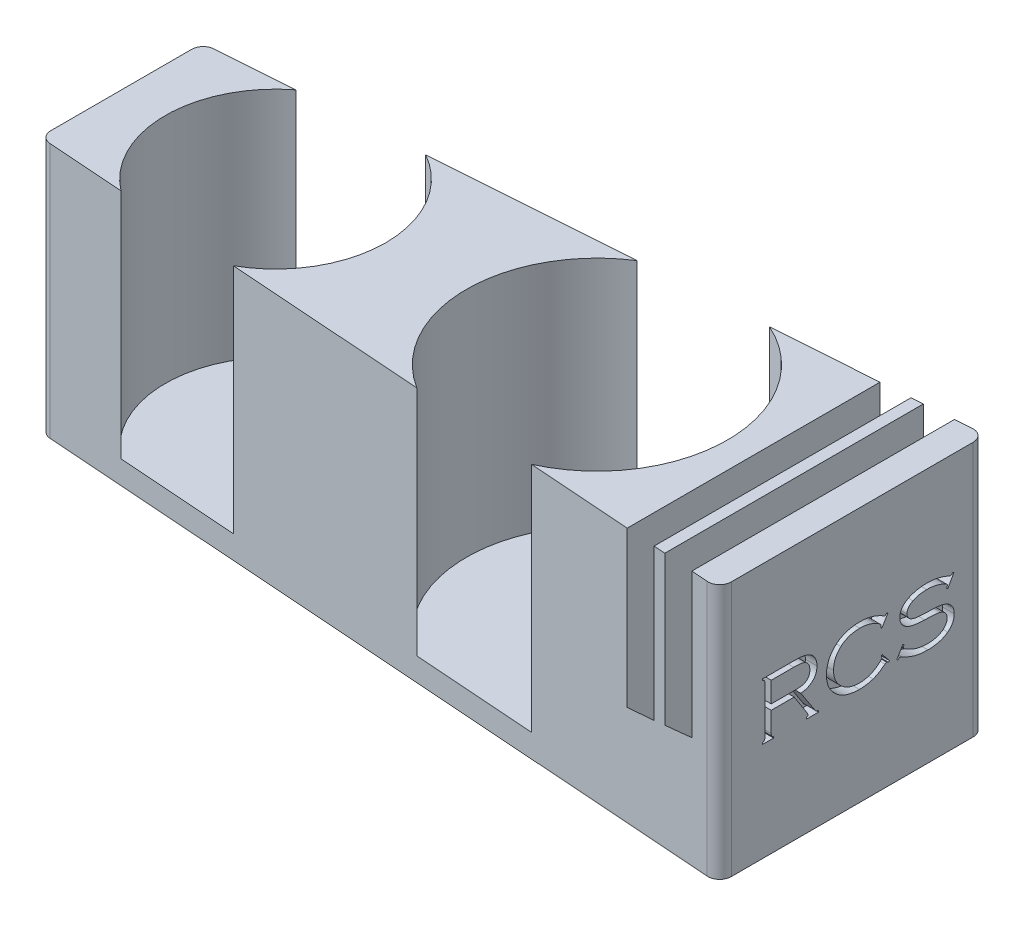
from build123d import *

# Parameters (mm, degrees)
BOSS_EXTRUDE1_DEPTH = 2
BOSS_EXTRUDE2_DEPTH = 20
BOSS_EXTRUDE3_DEPTH = 20
SKETCH5_R           = 12.25
CUT_EXTRUDE1_DEPTH  = 2.5
SKETCH6_W           = 22.642128751
SKETCH6_H           = 12.426012396
CUT_EXTRUDE3_DEPTH  = 2.5
BOSS_EXTRUDE4_DEPTH = 20
BOSS_EXTRUDE5_DEPTH = 20
SKETCH10_R          = 12.25
CUT_EXTRUDE4_DEPTH  = 2.5
CUT_EXTRUDE5_DEPTH  = 2.5
BOSS_EXTRUDE6_DEPTH = 20
SKETCH13_R          = 9.5
CUT_EXTRUDE6_DEPTH  = 20
SKETCH14_R          = 11.25
CUT_EXTRUDE7_DEPTH  = 20
CUT_EXTRUDE8_DEPTH  = 1
FILLET2_R           = 1


with BuildPart() as part:
    # Sketch1 → Boss-Extrude1 (new body)
    with BuildSketch(Plane(origin=(0, 0, 0), x_dir=(1, 0, 0), z_dir=(0, 1, 0))):
        Polygon((0, 7), (63, 11.5), (63, -11.5), (0, -7), align=None)
    extrude(amount=BOSS_EXTRUDE1_DEPTH)

    # Sketch2 → Boss-Extrude2 (add)
    with BuildSketch(Plane(origin=(0, 2, 0), x_dir=(1, 0, 0), z_dir=(0, 1, 0))):
        Polygon((60.497356291, 11.321239735), (60.497356495, -11.32123975), (63, -11.5), (63, 11.5), align=None)
    extrude(amount=BOSS_EXTRUDE2_DEPTH)

    # Sketch4 → Boss-Extrude3 (add)
    with BuildSketch(Plane(origin=(0, 2, 0), x_dir=(1, 0, 0), z_dir=(0, 1, 0))):
        Polygon((60.497356495, -11.32123975), (60.497356291, 11.321239735), (57.994932877, 11.142495206), (57.994869647, -11.142490689), align=None)
    extrude(amount=BOSS_EXTRUDE3_DEPTH)

    # Sketch5 → Cut-Extrude1 (cut)
    with BuildSketch(Plane(origin=(57.994901262, 0, 0.000164551), x_dir=(-2.8373318420964445e-06, 0, 0.9999999999959748), z_dir=(-0.9999999999959748, 0, -2.8373318420964445e-06))):
        with Locations((0, 14.252883097)):
            Circle(SKETCH5_R)
    extrude(amount=-CUT_EXTRUDE1_DEPTH, mode=Mode.SUBTRACT)

    # Sketch6 → Cut-Extrude3 (cut)
    with BuildSketch(Plane(origin=(60.494901262, 0, 0.000171644), x_dir=(-2.8373318420964445e-06, 0, 0.9999999999959748), z_dir=(-0.9999999999959748, 0, -2.8373318420964445e-06))):
        with Locations((-0.000173938, 15.786993802)):
            Rectangle(SKETCH6_W, SKETCH6_H)
    extrude(amount=CUT_EXTRUDE3_DEPTH, mode=Mode.SUBTRACT)

    # Sketch8 → Boss-Extrude4 (add)
    with BuildSketch(Plane(origin=(0, 2, 0), x_dir=(1, 0, 0), z_dir=(0, 1, 0))):
        Polygon((57.994932877, 11.142495206), (56.999996609, 11.071428329), (56.999996609, -11.071428329), (57.994869647, -11.142490689), align=None)
    extrude(amount=BOSS_EXTRUDE4_DEPTH)

    # Sketch9 → Boss-Extrude5 (add)
    with BuildSketch(Plane(origin=(0, 2, 0), x_dir=(1, 0, 0), z_dir=(0, 1, 0))):
        Polygon((56.999996609, 11.071428329), (54.502563696, 10.893040264), (54.502543833, -10.893038845), (56.999996609, -11.071428329), align=None)
    extrude(amount=BOSS_EXTRUDE5_DEPTH)

    # Sketch10 → Cut-Extrude4 (cut)
    with BuildSketch(Plane(origin=(54.502553764, 0, 4.9693e-05), x_dir=(-9.117571905251835e-07, 0, 0.9999999999995843), z_dir=(-0.9999999999995843, 0, -9.117571905251835e-07))):
        with Locations((0, 14.224043544)):
            Circle(SKETCH10_R)
    extrude(amount=-CUT_EXTRUDE4_DEPTH, mode=Mode.SUBTRACT)

    # Sketch11 → Cut-Extrude5 (cut)
    with BuildSketch(Plane(origin=(57.002553764, 0, 5.1972e-05), x_dir=(-9.117571905251564e-07, 0, 0.9999999999995843), z_dir=(-0.9999999999995843, 0, -9.117571905251564e-07))):
        Polygon((-11.071663677, 8.981833759), (-11.071663677, 22), (11.07155829, 22), (11.07155829, 8.981611185), align=None)
    extrude(amount=CUT_EXTRUDE5_DEPTH, mode=Mode.SUBTRACT)

    # Sketch12 → Boss-Extrude6 (add)
    with BuildSketch(Plane(origin=(0, 2, 0), x_dir=(1, 0, 0), z_dir=(0, 1, 0))):
        Polygon((54.502584484, 10.893041749), (0, 7), (0, -7), (54.502584484, -10.893041749), align=None)
    extrude(amount=BOSS_EXTRUDE6_DEPTH)

    # Sketch13 → Cut-Extrude6 (cut)
    with BuildSketch(Plane(origin=(0, 22, 0), x_dir=(1, 0, 0), z_dir=(0, 1, 0))):
        with Locations((13.3, 0)):
            Circle(SKETCH13_R)
    extrude(amount=-CUT_EXTRUDE6_DEPTH, mode=Mode.SUBTRACT)

    # Sketch14 → Cut-Extrude7 (cut)
    with BuildSketch(Plane(origin=(0, 22, 0), x_dir=(1, 0, 0), z_dir=(0, 1, 0))):
        with Locations((41, 0)):
            Circle(SKETCH14_R)
    extrude(amount=-CUT_EXTRUDE7_DEPTH, mode=Mode.SUBTRACT)

    # Sketch15 → Cut-Extrude8 (cut)
    # profile 1 of 3: a face of its own
    with BuildSketch(Plane(origin=(63, 0, 0), x_dir=(0, 0, -1), z_dir=(1, 0, 0))):
        with BuildLine():
            Line((-6.982134582, 10.694974764), (-6.982134582, 8.956091526))
            add(Edge.make_bspline(
                [(-6.982134582, 8.956091526), (-6.98203032, 8.933742839), (-6.981837395, 8.892389471), (-6.972993331, 8.83579956), (-6.960908862, 8.7889922), (-6.942711467, 8.750557828), (-6.914793079, 8.719830406), (-6.877736044, 8.694801894), (-6.831529024, 8.672431884), (-6.79677405, 8.66138617), (-6.77818493, 8.655478236)],
                knots=[0, 0, 0, 0, 1.327292751, 2.455984248, 3.396056187, 4.196519374, 4.957218112, 5.833575765, 6.841261664, 8, 8, 8, 8], degree=3))
            Line((-6.77818493, 8.655478236), (-6.77818493, 8.519511801))
            Line((-6.77818493, 8.519511801), (-7.729949976, 8.519511801))
            Line((-7.729949976, 8.519511801), (-7.729949976, 8.655478236))
            add(Edge.make_bspline(
                [(-7.729949976, 8.655478236), (-7.711360728, 8.661386131), (-7.676605517, 8.672431772), (-7.630400033, 8.694802253), (-7.593338257, 8.719829311), (-7.565435121, 8.750561413), (-7.547028033, 8.789288679), (-7.535088965, 8.83723176), (-7.526318586, 8.895587306), (-7.526111812, 8.938347235), (-7.526000323, 8.961402715)],
                knots=[0, 0, 0, 0, 1.143860438, 2.138607913, 3.003713363, 3.754644928, 4.544830376, 5.492870617, 6.648195317, 8, 8, 8, 8], degree=3))
            Line((-7.526000323, 8.961402715), (-7.526000323, 12.972412553))
            add(Edge.make_bspline(
                [(-7.526000323, 12.972412553), (-7.526093765, 12.995474411), (-7.526267067, 13.038246169), (-7.535300143, 13.096865855), (-7.546748119, 13.145350982), (-7.565774472, 13.184383007), (-7.592933314, 13.216087063), (-7.630227262, 13.241216836), (-7.676717319, 13.262338831), (-7.711381598, 13.272756611), (-7.729949976, 13.278337032)],
                knots=[0, 0, 0, 0, 1.348407392, 2.500828586, 3.466505965, 4.254705557, 5.01937148, 5.882302788, 6.865627628, 8, 8, 8, 8], degree=3))
            Line((-7.729949976, 13.278337032), (-7.729949976, 13.414303468))
            Line((-7.729949976, 13.414303468), (-5.039301692, 13.414303468))
            add(Edge.make_bspline(
                [(-5.039301692, 13.414303468), (-4.952191108, 13.413349297), (-4.787106619, 13.411541034), (-4.553852214, 13.401946133), (-4.349291413, 13.383055004), (-4.170247374, 13.35705029), (-4.01103459, 13.320553967), (-3.865238811, 13.273566558), (-3.729821486, 13.216139057), (-3.646949903, 13.167342893), (-3.606342934, 13.143432835)],
                knots=[0, 0, 0, 0, 1.414819568, 2.681244393, 3.790189265, 4.749857557, 5.617503166, 6.439488343, 7.235351294, 8, 8, 8, 8], degree=3))
            add(Edge.make_bspline(
                [(-3.606342934, 13.143432835), (-3.566545443, 13.116535819), (-3.487247757, 13.062942714), (-3.382735812, 12.962642943), (-3.287969844, 12.850478576), (-3.236992562, 12.765698165), (-3.211190481, 12.722786676)],
                knots=[0, 0, 0, 0, 0.987068848, 1.966764049, 2.970880412, 4, 4, 4, 4], degree=3))
            add(Edge.make_bspline(
                [(-3.211190481, 12.722786676), (-3.184578822, 12.671020272), (-3.131359455, 12.567495151), (-3.077529992, 12.399195757), (-3.044925246, 12.221631884), (-3.04107169, 12.099751935), (-3.039107962, 12.037643311)],
                knots=[0, 0, 0, 0, 0.976717653, 1.953290301, 2.95702022, 4, 4, 4, 4], degree=3))
            add(Edge.make_bspline(
                [(-3.039107962, 12.037643311), (-3.039873216, 11.991185871), (-3.041374861, 11.900023281), (-3.060707553, 11.766862005), (-3.088393102, 11.639461278), (-3.130357304, 11.519397342), (-3.182928982, 11.405536143), (-3.246294485, 11.297568771), (-3.323932811, 11.197872863), (-3.410681298, 11.103929581), (-3.508620654, 11.019297949), (-3.615309053, 10.943493938), (-3.730641581, 10.87750265), (-3.854686911, 10.8208524), (-3.987786372, 10.77448636), (-4.129402614, 10.737073713), (-4.279826924, 10.710876718), (-4.383114627, 10.700356366), (-4.435950636, 10.694974764)],
                knots=[0, 0, 0, 0, 1.032453981, 2.025965659, 2.986981725, 3.928436394, 4.848129052, 5.773335344, 6.705853521, 7.653153547, 8.613330213, 9.579206836, 10.559963337, 11.56437173, 12.608029044, 13.691145095, 14.818923504, 16, 16, 16, 16], degree=3))
            Line((-4.435950636, 10.694974764), (-3.218626146, 8.830747469))
            add(Edge.make_bspline(
                [(-3.218626146, 8.830747469), (-3.199710454, 8.804108531), (-3.163161857, 8.752637199), (-3.0878916, 8.695306346), (-2.999452337, 8.660549876), (-2.936044593, 8.657210882), (-2.903141527, 8.655478236)],
                knots=[0, 0, 0, 0, 1.032470711, 1.994923467, 2.959540884, 4, 4, 4, 4], degree=3))
            Line((-2.903141527, 8.655478236), (-2.903141527, 8.519511801))
            Line((-2.903141527, 8.519511801), (-3.952632448, 8.519511801))
            Line((-3.952632448, 8.519511801), (-3.952632448, 8.655478236))
            add(Edge.make_bspline(
                [(-3.952632448, 8.655478236), (-3.928342073, 8.660510858), (-3.885649027, 8.669356253), (-3.832012923, 8.688730584), (-3.794996608, 8.716948615), (-3.789421526, 8.741985285), (-3.786923355, 8.753204111)],
                knots=[0, 0, 0, 0, 1.445170674, 2.540048811, 3.345801974, 4, 4, 4, 4], degree=3))
            add(Edge.make_bspline(
                [(-3.786923355, 8.753204111), (-3.78914121, 8.762501108), (-3.795340142, 8.788486328), (-3.819357611, 8.835031451), (-3.854919302, 8.901796285), (-3.88539492, 8.952002333), (-3.902707273, 8.980522995)],
                knots=[0, 0, 0, 0, 0.44689934, 1.249089129, 2.437283923, 4, 4, 4, 4], degree=3))
            Line((-3.902707273, 8.980522995), (-5.004247845, 10.694974764))
            Line((-5.004247845, 10.694974764), (-6.982134582, 10.694974764))
        make_face()
        with BuildLine():
            Line((-6.982134582, 11.170857287), (-4.996812181, 11.170857287))
            add(Edge.make_bspline(
                [(-4.996812181, 11.170857287), (-4.933426113, 11.171209552), (-4.814761162, 11.171869028), (-4.649308652, 11.178009062), (-4.508573901, 11.188119218), (-4.389650544, 11.202722139), (-4.285863773, 11.223357022), (-4.191254555, 11.250860702), (-4.102617177, 11.285668697), (-4.047635802, 11.314809642), (-4.020615666, 11.329130715)],
                knots=[0, 0, 0, 0, 1.520823022, 2.847130214, 3.971774452, 4.905411492, 5.72015636, 6.507876598, 7.266708457, 8, 8, 8, 8], degree=3))
            add(Edge.make_bspline(
                [(-4.020615666, 11.329130715), (-3.990883778, 11.347671378), (-3.932591301, 11.384022287), (-3.8580126, 11.453952588), (-3.793008473, 11.53067471), (-3.740992586, 11.617699978), (-3.700021149, 11.713417146), (-3.672110068, 11.818634622), (-3.653150229, 11.932506741), (-3.651702635, 12.011712497), (-3.65095692, 12.05251464)],
                knots=[0, 0, 0, 0, 0.982641165, 1.926570845, 2.859311877, 3.801456098, 4.764550391, 5.776195376, 6.854426767, 8, 8, 8, 8], degree=3))
            add(Edge.make_bspline(
                [(-3.65095692, 12.05251464), (-3.652325105, 12.093634302), (-3.654979301, 12.173403965), (-3.671234745, 12.288492596), (-3.701546224, 12.394002377), (-3.742878847, 12.490892274), (-3.797223437, 12.578107123), (-3.863369099, 12.656109346), (-3.941197262, 12.724907694), (-4.000889772, 12.761528918), (-4.031238044, 12.780147516)],
                knots=[0, 0, 0, 0, 1.141908399, 2.215233359, 3.217213402, 4.181493512, 5.130824203, 6.058529557, 7.012936919, 8, 8, 8, 8], degree=3))
            add(Edge.make_bspline(
                [(-4.031238044, 12.780147516), (-4.060074346, 12.794717627), (-4.118139205, 12.824056044), (-4.209680673, 12.860972645), (-4.307029258, 12.886438761), (-4.411923863, 12.907688955), (-4.533666506, 12.922741418), (-4.679822592, 12.930781011), (-4.854409932, 12.937603578), (-4.980161109, 12.938135068), (-5.047799594, 12.938420944)],
                knots=[0, 0, 0, 0, 0.745341083, 1.500820907, 2.271778287, 3.063238885, 3.96911947, 5.09888871, 6.439563143, 8, 8, 8, 8], degree=3))
            Line((-5.047799594, 12.938420944), (-6.982134582, 12.938420944))
            Line((-6.982134582, 12.938420944), (-6.982134582, 11.170857287))
        make_face(mode=Mode.SUBTRACT)
    # profile 2 of 3: a face of its own
    with BuildSketch(Plane(origin=(63, 0, 0), x_dir=(0, 0, -1), z_dir=(1, 0, 0))):
        with BuildLine():
            Line((3.079381621, 12.938420944), (2.549324972, 12.05251464))
            Line((2.549324972, 12.05251464), (2.452661334, 12.113062193))
            add(Edge.make_bspline(
                [(2.452661334, 12.113062193), (2.462179093, 12.146823562), (2.478671449, 12.205325204), (2.482787707, 12.265900796), (2.484528467, 12.29151814)],
                knots=[0, 0, 0, 0, 1.154202433, 2, 2, 2, 2], degree=3))
            add(Edge.make_bspline(
                [(2.484528467, 12.29151814), (2.482818147, 12.305192437), (2.479128294, 12.334693427), (2.455365997, 12.378271109), (2.417899138, 12.422596157), (2.367527603, 12.470659576), (2.302144288, 12.519899021), (2.222785081, 12.571962308), (2.129592625, 12.626987002), (2.061580049, 12.662561565), (2.025641749, 12.681359403)],
                knots=[0, 0, 0, 0, 0.528427833, 1.140032483, 1.879037193, 2.768916703, 3.822049475, 5.035818927, 6.433706882, 8, 8, 8, 8], degree=3))
            add(Edge.make_bspline(
                [(2.025641749, 12.681359403), (1.972863624, 12.707578409), (1.867425708, 12.759957637), (1.703541591, 12.825393708), (1.536129283, 12.880146858), (1.366417125, 12.927997904), (1.192243788, 12.96233598), (1.015025993, 12.988154802), (0.833714414, 13.003122129), (0.711680024, 13.005302777), (0.65004383, 13.006404162)],
                knots=[0, 0, 0, 0, 0.990833998, 1.979446473, 2.964339273, 3.952521199, 4.942889807, 5.947602928, 6.963391035, 8, 8, 8, 8], degree=3))
            add(Edge.make_bspline(
                [(0.65004383, 13.006404162), (0.568165663, 13.004993454), (0.408205408, 13.002237441), (0.174657661, 12.974270561), (-0.047386934, 12.932903594), (-0.257657796, 12.872174104), (-0.456089905, 12.793323635), (-0.642708881, 12.697150136), (-0.818465533, 12.58520431), (-0.924391536, 12.49631744), (-0.977304441, 12.451916044)],
                knots=[0, 0, 0, 0, 1.116881908, 2.181982346, 3.205473248, 4.196440491, 5.163727822, 6.11461875, 7.058201043, 8, 8, 8, 8], degree=3))
            add(Edge.make_bspline(
                [(-0.977304441, 12.451916044), (-1.028046738, 12.404165549), (-1.128134025, 12.30997948), (-1.256399707, 12.150910825), (-1.367212256, 11.983617274), (-1.45720985, 11.804671851), (-1.52584861, 11.614725546), (-1.575951043, 11.415156822), (-1.606543823, 11.20508892), (-1.6097969, 11.061551604), (-1.611460392, 10.98815239)],
                knots=[0, 0, 0, 0, 1.014640989, 2.001341491, 2.970512027, 3.935371108, 4.913448052, 5.908657242, 6.930571361, 8, 8, 8, 8], degree=3))
            add(Edge.make_bspline(
                [(-1.611460392, 10.98815239), (-1.609428616, 10.915097287), (-1.605435199, 10.771508945), (-1.573670839, 10.561157973), (-1.523165176, 10.360043096), (-1.450176565, 10.168393728), (-1.356416157, 9.986574464), (-1.242419385, 9.81399939), (-1.108880533, 9.650115199), (-1.004698757, 9.552631643), (-0.951810734, 9.50314398)],
                knots=[0, 0, 0, 0, 1.045243101, 2.054404389, 3.037758508, 4.008189886, 4.982846867, 5.959767557, 6.964273164, 8, 8, 8, 8], degree=3))
            add(Edge.make_bspline(
                [(-0.951810734, 9.50314398), (-0.897778438, 9.457082592), (-0.790722385, 9.365819573), (-0.616001987, 9.248827964), (-0.432605487, 9.149263959), (-0.239110327, 9.06870713), (-0.037082686, 9.004200384), (0.174819738, 8.960593878), (0.395354764, 8.931440664), (0.545847079, 8.928770056), (0.622425648, 8.927411106)],
                knots=[0, 0, 0, 0, 0.992433811, 1.966343341, 2.934746802, 3.906992647, 4.893800048, 5.896242675, 6.929495341, 8, 8, 8, 8], degree=3))
            add(Edge.make_bspline(
                [(0.622425648, 8.927411106), (0.697584829, 8.928810155), (0.846303085, 8.931578468), (1.065428974, 8.960685023), (1.278101894, 9.004754649), (1.483896357, 9.067876611), (1.683144736, 9.148586089), (1.875111058, 9.248354906), (2.061145178, 9.365000317), (2.177250448, 9.456042004), (2.235964828, 9.502081743)],
                knots=[0, 0, 0, 0, 1.031172007, 2.040390831, 3.028950235, 4.009892534, 4.991015447, 5.975791656, 6.976358799, 8, 8, 8, 8], degree=3))
            add(Edge.make_bspline(
                [(2.235964828, 9.502081743), (2.260982462, 9.520913292), (2.308283668, 9.556518377), (2.371508327, 9.611121613), (2.426212095, 9.659816709), (2.47111536, 9.703971392), (2.505667085, 9.74454985), (2.530444481, 9.780644398), (2.547183446, 9.812700453), (2.55013699, 9.833719776), (2.551449447, 9.843060068)],
                knots=[0, 0, 0, 0, 1.587426528, 3.001370576, 4.234572792, 5.301084547, 6.1931032, 6.9301606, 7.524598697, 8, 8, 8, 8], degree=3))
            add(Edge.make_bspline(
                [(2.551449447, 9.843060068), (2.550266884, 9.852664633), (2.547507241, 9.875077971), (2.536114179, 9.912637592), (2.516622035, 9.957842473), (2.499977832, 9.990111116), (2.490901894, 10.007706924)],
                knots=[0, 0, 0, 0, 0.656862919, 1.532863812, 2.654692323, 4, 4, 4, 4], degree=3))
            Line((2.490901894, 10.007706924), (2.576943154, 10.075690141))
            Line((2.576943154, 10.075690141), (3.215348057, 9.301318803))
            Line((3.215348057, 9.301318803), (3.126120084, 9.226962159))
            add(Edge.make_bspline(
                [(3.126120084, 9.226962159), (3.110528362, 9.240892316), (3.081940918, 9.266433278), (3.037826825, 9.295005923), (2.998642682, 9.315887794), (2.972284292, 9.318293279), (2.960410991, 9.319376845)],
                knots=[0, 0, 0, 0, 1.293860952, 2.372295961, 3.266790553, 4, 4, 4, 4], degree=3))
            add(Edge.make_bspline(
                [(2.960410991, 9.319376845), (2.952538322, 9.317886663), (2.933575852, 9.314297341), (2.902554707, 9.299305983), (2.86547995, 9.273696064), (2.838517988, 9.253289273), (2.823382318, 9.241833488)],
                knots=[0, 0, 0, 0, 0.602339461, 1.450822395, 2.56896506, 4, 4, 4, 4], degree=3))
            add(Edge.make_bspline(
                [(2.823382318, 9.241833488), (2.770823353, 9.201557917), (2.671150152, 9.125179033), (2.526728971, 9.020891424), (2.396319582, 8.932737807), (2.240918164, 8.834715467), (2.044671434, 8.733153815), (1.880819411, 8.671863048), (1.797260627, 8.640606907)],
                knots=[0, 0, 0, 0, 0.997120743, 1.890946972, 2.68215169, 3.367178705, 4.657353487, 6, 6, 6, 6], degree=3))
            add(Edge.make_bspline(
                [(1.797260627, 8.640606907), (1.70605278, 8.611102243), (1.521271781, 8.551327766), (1.230352432, 8.495640518), (0.927249277, 8.457464905), (0.720278877, 8.453530217), (0.614989984, 8.451528583)],
                knots=[0, 0, 0, 0, 0.955610556, 1.936003082, 2.950014347, 4, 4, 4, 4], degree=3))
            add(Edge.make_bspline(
                [(0.614989984, 8.451528583), (0.513643434, 8.453507712), (0.315386093, 8.457379346), (0.025339968, 8.489421013), (-0.249468248, 8.543894493), (-0.510578597, 8.617586033), (-0.756571693, 8.715210694), (-0.989360615, 8.831558359), (-1.20701055, 8.971302732), (-1.339161296, 9.080758115), (-1.405386264, 9.13560971)],
                knots=[0, 0, 0, 0, 1.114924198, 2.181050147, 3.205656836, 4.194615827, 5.161896158, 6.113211609, 7.054469962, 8, 8, 8, 8], degree=3))
            add(Edge.make_bspline(
                [(-1.405386264, 9.13560971), (-1.470459923, 9.195905408), (-1.598801049, 9.314823227), (-1.76564427, 9.513552706), (-1.907474502, 9.724191814), (-2.022547456, 9.947962028), (-2.113733323, 10.183469108), (-2.177006639, 10.432037488), (-2.216384935, 10.692649856), (-2.220971906, 10.870809305), (-2.223309351, 10.961596445)],
                knots=[0, 0, 0, 0, 1.029468752, 2.03036344, 3.005483654, 3.972873955, 4.946545143, 5.931937644, 6.94614926, 8, 8, 8, 8], degree=3))
            add(Edge.make_bspline(
                [(-2.223309351, 10.961596445), (-2.221536049, 11.033530972), (-2.218049851, 11.174949608), (-2.19466961, 11.383658823), (-2.153779514, 11.584502156), (-2.09910939, 11.778955644), (-2.026418503, 11.965494476), (-1.937203367, 12.144285764), (-1.835393377, 12.31787734), (-1.753537132, 12.424735026), (-1.712372981, 12.478471988)],
                knots=[0, 0, 0, 0, 1.057821681, 2.079609136, 3.08340757, 4.068984952, 5.046566163, 6.022259667, 7.005427102, 8, 8, 8, 8], degree=3))
            add(Edge.make_bspline(
                [(-1.712372981, 12.478471988), (-1.678542927, 12.519291284), (-1.611145813, 12.600612545), (-1.50113147, 12.714181085), (-1.385601238, 12.820350477), (-1.263772608, 12.918967898), (-1.135155844, 13.008635207), (-1.001272429, 13.092232357), (-0.860354242, 13.166307169), (-0.713799708, 13.23367393), (-0.560541003, 13.291565971), (-0.401462946, 13.342979287), (-0.236241848, 13.386422634), (-0.064506281, 13.421163227), (0.113002012, 13.449146762), (0.297069688, 13.467658591), (0.487360394, 13.479736372), (0.616387328, 13.481427753), (0.681910963, 13.482286685)],
                knots=[0, 0, 0, 0, 0.945323297, 1.883297627, 2.817501084, 3.742673649, 4.67655684, 5.612445219, 6.556058172, 7.514122137, 8.487631749, 9.476265062, 10.49494205, 11.532877102, 12.600271702, 13.698751591, 14.831359033, 16, 16, 16, 16], degree=3))
            add(Edge.make_bspline(
                [(0.681910963, 13.482286685), (0.769440876, 13.480372077), (0.944573743, 13.476541262), (1.205796604, 13.447897048), (1.465053971, 13.402608945), (1.7214737, 13.337100685), (1.97642382, 13.254131093), (2.22885293, 13.151765323), (2.479601221, 13.03189583), (2.641601839, 12.938776576), (2.723531967, 12.891682482)],
                knots=[0, 0, 0, 0, 0.976200939, 1.953216504, 2.927882183, 3.909755422, 4.902711129, 5.916307441, 6.946194151, 8, 8, 8, 8], degree=3))
            add(Edge.make_bspline(
                [(2.723531967, 12.891682482), (2.741536795, 12.881739169), (2.770215569, 12.865901082), (2.801994416, 12.858369555), (2.813822178, 12.855566398)],
                knots=[0, 0, 0, 0, 1.255620471, 2, 2, 2, 2], degree=3))
            add(Edge.make_bspline(
                [(2.813822178, 12.855566398), (2.823260125, 12.857895583), (2.847904436, 12.863977536), (2.884655343, 12.894226173), (2.931803861, 12.937857783), (2.964307302, 12.974836311), (2.982717984, 12.995781784)],
                knots=[0, 0, 0, 0, 0.518788388, 1.354657101, 2.501618075, 4, 4, 4, 4], degree=3))
            Line((2.982717984, 12.995781784), (3.079381621, 12.938420944))
        make_face()
    # profile 3 of 3: a face of its own
    with BuildSketch(Plane(origin=(63, 0, 0), x_dir=(0, 0, -1), z_dir=(1, 0, 0))):
        with BuildLine():
            Line((8.75598029, 13.104130037), (8.242919445, 12.182107649))
            Line((8.242919445, 12.182107649), (8.143069094, 12.235219537))
            add(Edge.make_bspline(
                [(8.143069094, 12.235219537), (8.152000707, 12.259623002), (8.167859704, 12.302953862), (8.1877451, 12.360343563), (8.199086162, 12.403044962), (8.202346668, 12.426749479), (8.203616647, 12.435982477)],
                knots=[0, 0, 0, 0, 1.483757732, 2.634564283, 3.46815771, 4, 4, 4, 4], degree=3))
            add(Edge.make_bspline(
                [(8.203616647, 12.435982477), (8.20276099, 12.445340289), (8.200973896, 12.464884678), (8.186367066, 12.492994361), (8.166233472, 12.522078608), (8.136287334, 12.550967599), (8.09829155, 12.58009639), (8.052047274, 12.609533819), (7.998730438, 12.64110442), (7.959130031, 12.659751822), (7.938057204, 12.669674787)],
                knots=[0, 0, 0, 0, 0.607169636, 1.268112509, 2.03013931, 2.91146364, 3.96412496, 5.148481403, 6.482602449, 8, 8, 8, 8], degree=3))
            add(Edge.make_bspline(
                [(7.938057204, 12.669674787), (7.877753777, 12.696448931), (7.757637888, 12.749779235), (7.573592317, 12.819373283), (7.38621591, 12.875875899), (7.19660337, 12.924975255), (7.003640857, 12.959898395), (6.808451924, 12.987066801), (6.610538559, 13.00335996), (6.477509681, 13.005385004), (6.410559283, 13.006404162)],
                knots=[0, 0, 0, 0, 1.004211035, 2.000246224, 2.992453697, 3.98197883, 4.979849601, 5.975301357, 6.9810154, 8, 8, 8, 8], degree=3))
            add(Edge.make_bspline(
                [(6.410559283, 13.006404162), (6.354956921, 13.005414831), (6.245777373, 13.003472204), (6.084720207, 12.993308006), (5.929504218, 12.973779078), (5.77928207, 12.947863115), (5.634910366, 12.91207915), (5.495137457, 12.871242319), (5.361253544, 12.821600842), (5.275841804, 12.78178242), (5.233599829, 12.762089474)],
                knots=[0, 0, 0, 0, 1.100774022, 2.161455134, 3.192520597, 4.19620711, 5.177095061, 6.135103414, 7.077680479, 8, 8, 8, 8], degree=3))
            add(Edge.make_bspline(
                [(5.233599829, 12.762089474), (5.194768097, 12.741444526), (5.119177917, 12.701256895), (5.017594338, 12.62598532), (4.926051437, 12.545043843), (4.850294823, 12.453388752), (4.787965171, 12.357587851), (4.743897675, 12.257151243), (4.715637833, 12.154265777), (4.712527243, 12.08420366), (4.710978844, 12.049327927)],
                knots=[0, 0, 0, 0, 1.13355636, 2.206590414, 3.254740046, 4.27976559, 5.265963583, 6.194811322, 7.101407709, 8, 8, 8, 8], degree=3))
            add(Edge.make_bspline(
                [(4.710978844, 12.049327927), (4.712122584, 12.020176813), (4.714410149, 11.96187243), (4.735674417, 11.875792985), (4.770071393, 11.792641753), (4.816625906, 11.713029411), (4.874859121, 11.64068635), (4.941370465, 11.575756007), (5.01706097, 11.520785157), (5.073439496, 11.49365539), (5.101882345, 11.47996848)],
                knots=[0, 0, 0, 0, 0.957919062, 1.915908973, 2.898175121, 3.911258258, 4.939304541, 5.944518821, 6.963014016, 8, 8, 8, 8], degree=3))
            add(Edge.make_bspline(
                [(5.101882345, 11.47996848), (5.135298741, 11.465908726), (5.204252309, 11.436896917), (5.314788859, 11.404115442), (5.433426938, 11.37570413), (5.539634143, 11.359879488), (5.633233943, 11.348538376), (5.714723827, 11.341313202), (5.806481577, 11.335223733), (5.908454511, 11.328786735), (6.021059446, 11.322526799), (6.143899968, 11.315933251), (6.277046664, 11.310681279), (6.369129011, 11.308141977), (6.41693271, 11.306823722)],
                knots=[0, 0, 0, 0, 0.977326068, 2.016678256, 3.105629518, 4.266128525, 4.9106475, 5.649171883, 6.472626623, 7.391392157, 8.405507546, 9.51500178, 10.709936153, 12, 12, 12, 12], degree=3))
            add(Edge.make_bspline(
                [(6.41693271, 11.306823722), (6.483154633, 11.304939104), (6.610674613, 11.301309996), (6.794750386, 11.2922125), (6.964345803, 11.283652818), (7.119193769, 11.276106831), (7.258963086, 11.264681426), (7.384386557, 11.2545656), (7.495281184, 11.243151137), (7.621285795, 11.226415359), (7.762066459, 11.201627674), (7.91659088, 11.16129339), (8.056075286, 11.112649728), (8.13994124, 11.069457993), (8.180247416, 11.048699943)],
                knots=[0, 0, 0, 0, 1.327296927, 2.555903972, 3.692392932, 4.729698951, 5.661742112, 6.501857616, 7.250824416, 7.89495221, 9.048516985, 10.111912734, 11.092580788, 12, 12, 12, 12], degree=3))
            add(Edge.make_bspline(
                [(8.180247416, 11.048699943), (8.228930084, 11.019902102), (8.323561679, 10.96392354), (8.447980554, 10.8599853), (8.553618072, 10.746104781), (8.642012912, 10.621548222), (8.707110754, 10.484056319), (8.755759262, 10.336869252), (8.784868308, 10.178097157), (8.788238736, 10.068376927), (8.789971899, 10.011955875)],
                knots=[0, 0, 0, 0, 1.069345705, 2.078643101, 3.055776152, 4.004137249, 4.9574836, 5.924075733, 6.932504666, 8, 8, 8, 8], degree=3))
            add(Edge.make_bspline(
                [(8.789971899, 10.011955875), (8.788531086, 9.957658148), (8.785706539, 9.851213786), (8.75772971, 9.695521714), (8.714724389, 9.547337508), (8.65318516, 9.406446926), (8.574500534, 9.272967986), (8.476367481, 9.148378767), (8.362421271, 9.030383071), (8.275606582, 8.960833851), (8.23123483, 8.925286631)],
                knots=[0, 0, 0, 0, 1.025233928, 2.009851588, 2.979622151, 3.935627171, 4.907680718, 5.899548307, 6.926440625, 8, 8, 8, 8], degree=3))
            add(Edge.make_bspline(
                [(8.23123483, 8.925286631), (8.177886614, 8.886800871), (8.069998911, 8.80896996), (7.890406488, 8.714945306), (7.698830512, 8.631857767), (7.491278052, 8.567034134), (7.269847096, 8.514685821), (7.033307802, 8.478190045), (6.782433929, 8.45551916), (6.610310292, 8.452880789), (6.52209425, 8.451528583)],
                knots=[0, 0, 0, 0, 0.873662435, 1.766833848, 2.688584958, 3.647476082, 4.653577257, 5.711695763, 6.827208478, 8, 8, 8, 8], degree=3))
            add(Edge.make_bspline(
                [(6.52209425, 8.451528583), (6.420772677, 8.452720128), (6.224568543, 8.455027494), (5.940557957, 8.479401825), (5.675968209, 8.515320734), (5.466855531, 8.560292463), (5.304469966, 8.606584046), (5.179073933, 8.647034626), (5.048126632, 8.694122662), (4.911375746, 8.747160201), (4.768487505, 8.806699337), (4.620607751, 8.874057381), (4.465924874, 8.945693783), (4.36240511, 8.998252362), (4.309452965, 9.025136982)],
                knots=[0, 0, 0, 0, 1.577079198, 3.053934603, 4.434610073, 5.73212484, 6.37954586, 7.062931899, 7.783061352, 8.545736752, 9.346338084, 10.192645224, 11.075506861, 12, 12, 12, 12], degree=3))
            add(Edge.make_bspline(
                [(4.309452965, 9.025136982), (4.282265735, 9.037377601), (4.23450551, 9.058880886), (4.171831527, 9.084267346), (4.128139764, 9.100950645), (4.104489645, 9.10534228), (4.095943172, 9.10692929)],
                knots=[0, 0, 0, 0, 1.560868491, 2.742001726, 3.545395613, 4, 4, 4, 4], degree=3))
            add(Edge.make_bspline(
                [(4.095943172, 9.10692929), (4.08508552, 9.104688179), (4.059473948, 9.099401734), (4.020576408, 9.072206682), (3.974360211, 9.031844791), (3.942639672, 8.997551984), (3.92492289, 8.97839852)],
                knots=[0, 0, 0, 0, 0.606031744, 1.429537914, 2.564327146, 4, 4, 4, 4], degree=3))
            Line((3.92492289, 8.97839852), (3.827197015, 9.038946073))
            Line((3.827197015, 9.038946073), (4.365751567, 9.938661468))
            Line((4.365751567, 9.938661468), (4.466664155, 9.881300628))
            add(Edge.make_bspline(
                [(4.466664155, 9.881300628), (4.456489722, 9.859450657), (4.438122221, 9.820005769), (4.416918129, 9.765799136), (4.402472826, 9.723374785), (4.399787562, 9.698304903), (4.398680938, 9.687973353)],
                knots=[0, 0, 0, 0, 1.403778314, 2.534185348, 3.39592305, 4, 4, 4, 4], degree=3))
            add(Edge.make_bspline(
                [(4.398680938, 9.687973353), (4.400495789, 9.677447748), (4.404606264, 9.653608188), (4.429583615, 9.618944329), (4.465149671, 9.580162496), (4.517145941, 9.538992979), (4.581433126, 9.492115773), (4.661709741, 9.443061756), (4.755128806, 9.388742788), (4.822746895, 9.352447053), (4.858629894, 9.333185936)],
                knots=[0, 0, 0, 0, 0.42669469, 0.966425524, 1.685134264, 2.558661903, 3.634421735, 4.900364347, 6.355111387, 8, 8, 8, 8], degree=3))
            add(Edge.make_bspline(
                [(4.858629894, 9.333185936), (4.926653653, 9.299245467), (5.059834038, 9.232795085), (5.260544672, 9.146376506), (5.457850761, 9.075929495), (5.653242271, 9.01966096), (5.851411596, 8.978110266), (6.055356107, 8.948251684), (6.267937361, 8.931465816), (6.412301272, 8.92878121), (6.485978165, 8.927411106)],
                knots=[0, 0, 0, 0, 1.076161654, 2.10696419, 3.091620022, 4.040495012, 4.983378908, 5.956055965, 6.956862242, 8, 8, 8, 8], degree=3))
            add(Edge.make_bspline(
                [(6.485978165, 8.927411106), (6.559686976, 8.928400097), (6.702443627, 8.930315541), (6.909549085, 8.951733754), (7.10342873, 8.982160454), (7.283492269, 9.028218254), (7.450518542, 9.085918759), (7.60255815, 9.159037797), (7.743080822, 9.241961635), (7.82520891, 9.310107194), (7.865825035, 9.343808314)],
                knots=[0, 0, 0, 0, 1.200581144, 2.32524367, 3.389485329, 4.395619224, 5.349982135, 6.263570837, 7.141255747, 8, 8, 8, 8], degree=3))
            add(Edge.make_bspline(
                [(7.865825035, 9.343808314), (7.890703037, 9.367086978), (7.939429157, 9.41268063), (8.003490058, 9.487211146), (8.05705908, 9.565874336), (8.101898997, 9.647072795), (8.136051053, 9.732051824), (8.161116384, 9.819882407), (8.17449764, 9.911342427), (8.17690916, 9.973323513), (8.178122941, 10.00452021)],
                knots=[0, 0, 0, 0, 1.083558152, 2.1222598, 3.119120567, 4.107285013, 5.06756785, 6.027057283, 7.006966457, 8, 8, 8, 8], degree=3))
            add(Edge.make_bspline(
                [(8.178122941, 10.00452021), (8.176461827, 10.044993214), (8.173238306, 10.123534214), (8.149129537, 10.236794), (8.105246659, 10.339342602), (8.046684536, 10.432780754), (7.970499342, 10.51627011), (7.877044617, 10.588252854), (7.766947486, 10.650499002), (7.686049135, 10.682511869), (7.64381734, 10.699223715)],
                knots=[0, 0, 0, 0, 1.029839954, 1.998484261, 2.92737069, 3.854901048, 4.79266239, 5.787731937, 6.845117989, 8, 8, 8, 8], degree=3))
            add(Edge.make_bspline(
                [(7.64381734, 10.699223715), (7.58582364, 10.718215121), (7.469500516, 10.756307873), (7.329288885, 10.777402462), (7.223185189, 10.78468904), (7.14531772, 10.790268743), (7.046123126, 10.795023317), (6.925781016, 10.801938256), (6.784099824, 10.80764674), (6.620911207, 10.815671929), (6.436750709, 10.822549547), (6.30681152, 10.828049031), (6.238476764, 10.830941199)],
                knots=[0, 0, 0, 0, 1.290798322, 2.589069018, 2.987663341, 3.543878352, 4.242322354, 5.09093925, 6.096854991, 7.245451188, 8.551388372, 10, 10, 10, 10], degree=3))
            add(Edge.make_bspline(
                [(6.238476764, 10.830941199), (6.188541105, 10.83285517), (6.091460548, 10.836576146), (5.949856993, 10.845496064), (5.816695115, 10.854783644), (5.691701636, 10.86551406), (5.575175281, 10.877019943), (5.466819642, 10.889821395), (5.36680849, 10.903155145), (5.246072685, 10.924435388), (5.104460171, 10.955637555), (4.944148272, 11.004766462), (4.792660142, 11.062626266), (4.698200578, 11.110880915), (4.651493528, 11.134741203)],
                knots=[0, 0, 0, 0, 1.103426511, 2.145185674, 3.132844786, 4.050961383, 4.915301806, 5.718303595, 6.460251326, 7.142805982, 8.425063637, 9.659245979, 10.84257654, 12, 12, 12, 12], degree=3))
            add(Edge.make_bspline(
                [(4.651493528, 11.134741203), (4.610357648, 11.158740101), (4.528985168, 11.206213254), (4.42062299, 11.297406153), (4.325865813, 11.401914438), (4.244892337, 11.518956489), (4.180534753, 11.645927687), (4.133142328, 11.779673503), (4.104763062, 11.919252781), (4.101020303, 12.014145656), (4.099129885, 12.06207478)],
                knots=[0, 0, 0, 0, 1.00717862, 1.992339131, 2.985119907, 3.987793364, 4.997314523, 5.991114465, 6.985338751, 8, 8, 8, 8], degree=3))
            add(Edge.make_bspline(
                [(4.099129885, 12.06207478), (4.100311081, 12.102876715), (4.102655838, 12.18387144), (4.122696584, 12.302692023), (4.152886135, 12.417851182), (4.198538916, 12.527416917), (4.254855673, 12.63349992), (4.324424327, 12.734267837), (4.405891378, 12.831448134), (4.468493748, 12.890186184), (4.500655764, 12.920362902)],
                knots=[0, 0, 0, 0, 1.000983626, 1.987023238, 2.950663146, 3.917551529, 4.893656174, 5.894224556, 6.918156239, 8, 8, 8, 8], degree=3))
            add(Edge.make_bspline(
                [(4.500655764, 12.920362902), (4.526217593, 12.941964734), (4.578351876, 12.98602246), (4.663498924, 13.046557493), (4.756639805, 13.102078909), (4.854841278, 13.157357881), (4.962263797, 13.205196169), (5.075189206, 13.252413266), (5.195974105, 13.294605672), (5.366850164, 13.347296423), (5.59155851, 13.402509459), (5.872808469, 13.448814753), (6.166385731, 13.476744475), (6.366237804, 13.480417762), (6.467920123, 13.482286685)],
                knots=[0, 0, 0, 0, 0.577531334, 1.177896235, 1.80052757, 2.448789327, 3.12153943, 3.828643486, 4.561278066, 5.328774236, 6.914895883, 8.550686374, 10.245030914, 12, 12, 12, 12], degree=3))
            add(Edge.make_bspline(
                [(6.467920123, 13.482286685), (6.548322132, 13.480904921), (6.706472186, 13.478187003), (6.939540092, 13.461445047), (7.163680255, 13.431757086), (7.382822261, 13.389341166), (7.604687735, 13.333244886), (7.835614869, 13.25875395), (8.080991295, 13.169979595), (8.246442607, 13.099310036), (8.332147418, 13.062702764)],
                knots=[0, 0, 0, 0, 1.001779309, 1.970491218, 2.909495588, 3.817092542, 4.750108648, 5.758857613, 6.839074275, 8, 8, 8, 8], degree=3))
            add(Edge.make_bspline(
                [(8.332147418, 13.062702764), (8.350132057, 13.055400906), (8.38202973, 13.042450282), (8.424805204, 13.02818072), (8.455567239, 13.016958628), (8.473027269, 13.014711348), (8.479798469, 13.013839826)],
                knots=[0, 0, 0, 0, 1.493082902, 2.648141695, 3.475733888, 4, 4, 4, 4], degree=3))
            add(Edge.make_bspline(
                [(8.479798469, 13.013839826), (8.491778729, 13.015922925), (8.520103295, 13.020847933), (8.560975091, 13.051447718), (8.607768255, 13.095143703), (8.638175709, 13.132333337), (8.655067702, 13.152992975)],
                knots=[0, 0, 0, 0, 0.630011535, 1.489517125, 2.605372993, 4, 4, 4, 4], degree=3))
            Line((8.655067702, 13.152992975), (8.75598029, 13.104130037))
        make_face()
    extrude(amount=-CUT_EXTRUDE8_DEPTH, mode=Mode.SUBTRACT)

    # Fillet2
    fillet2_edges = [part.edges().sort_by_distance(p)[0] for p in [
        (0, 11, -7),
        (63, 11, -11.5),
        (63, 11, 11.5),
        (0, 11, 7),
    ]]
    fillet(fillet2_edges, radius=FILLET2_R)


solid = part.part
